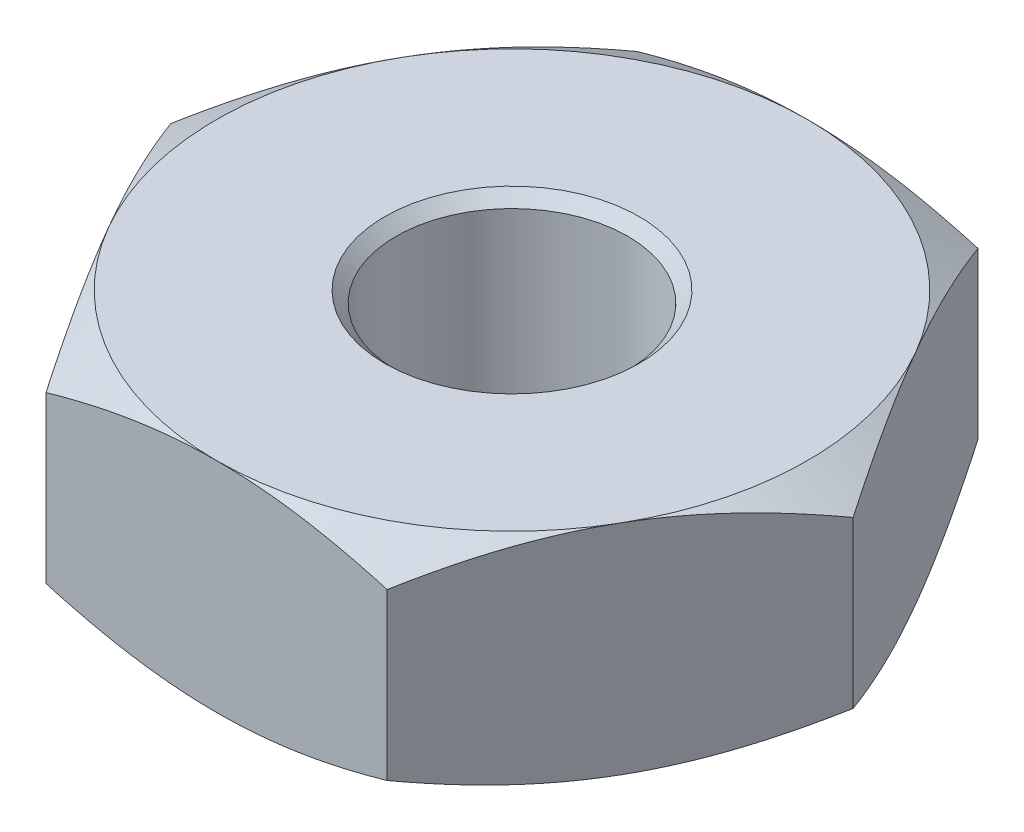
from build123d import *

# Parameters (mm, degrees)
BOSS_EXTRUDE1_DEPTH    = 9.6
SKETCH2_OUTSIDE_W      = 73.45
SKETCH2_OUTSIDE_H      = 69.428
SKETCH2_OUTSIDE_R      = 13
CUT_EXTRUDE1_DEPTH     = 9.6
CUT_EXTRUDE1_DRAFT     = -60
SKETCH3_OUTSIDE_W      = 73.45
SKETCH3_OUTSIDE_H      = 69.428
SKETCH3_OUTSIDE_R      = 13
CUT_EXTRUDE2_DEPTH     = 9.6
CUT_EXTRUDE2_DRAFT     = -60
M12_TAPPED_HOLE1_D     = 10.2
M12_TAPPED_HOLE1_DEPTH = 32.75
CHAMFER1_SIZE          = 0.5


with BuildPart() as part:
    # Sketch1 → Boss-Extrude1 (new body)
    with BuildSketch(Plane(origin=(0, 0, 0), x_dir=(1, 0, 0), z_dir=(0, 1, 0))):
        Polygon((15.011106999, 0), (7.505553499, 13), (-7.505553499, 13), (-15.011106999, 0), (-7.505553499, -13), (7.505553499, -13), align=None)
    extrude(amount=BOSS_EXTRUDE1_DEPTH)


with BuildPart() as cut_extrude1_tool:
    # Sketch2 outside → Cut-Extrude1 (with draft: the straight prism first)
    with BuildSketch(Plane(origin=(0, 9.6, 0), x_dir=(1, 0, 0), z_dir=(0, 1, 0))):
        Rectangle(SKETCH2_OUTSIDE_W, SKETCH2_OUTSIDE_H)
        Circle(SKETCH2_OUTSIDE_R, mode=Mode.SUBTRACT)
    extrude(amount=-CUT_EXTRUDE1_DEPTH)
    # Cut-Extrude1: the draft: its side faces are tilted about the plane it starts from
    cut_extrude1_sides = [cut_extrude1_tool.faces().sort_by_distance(p)[0] for p in [
        (0, 4.8, 34.714),
        (36.725, 4.8, 0),
        (0, 4.8, -34.714),
        (-36.725, 4.8, 0),
        (-13, 4.8, 0),
    ]]
    draft(cut_extrude1_sides, Plane(origin=(0, 9.6, 0), x_dir=(1, 0, 0), z_dir=(0, 1, 0)), CUT_EXTRUDE1_DRAFT)


with BuildPart() as part_1:
    add(part.part)

    # Cut-Extrude1: cut by cut_extrude1_tool
    add(cut_extrude1_tool.part, mode=Mode.SUBTRACT)


with BuildPart() as cut_extrude2_tool:
    # Sketch3 outside → Cut-Extrude2 (with draft: the straight prism first)
    with BuildSketch(Plane.XZ):
        Rectangle(SKETCH3_OUTSIDE_W, SKETCH3_OUTSIDE_H)
        Circle(SKETCH3_OUTSIDE_R, mode=Mode.SUBTRACT)
    extrude(amount=-CUT_EXTRUDE2_DEPTH)
    # Cut-Extrude2: the draft: its side faces are tilted about the plane it starts from
    cut_extrude2_sides = [cut_extrude2_tool.faces().sort_by_distance(p)[0] for p in [
        (0, 4.8, -34.714),
        (36.725, 4.8, 0),
        (0, 4.8, 34.714),
        (-36.725, 4.8, 0),
        (-13, 4.8, 0),
    ]]
    draft(cut_extrude2_sides, Plane.XZ, CUT_EXTRUDE2_DRAFT)


with BuildPart() as part_2:
    add(part_1.part)

    # Cut-Extrude2: cut by cut_extrude2_tool
    add(cut_extrude2_tool.part, mode=Mode.SUBTRACT)

    # M12 Tapped Hole1
    with Locations(Plane(origin=(0, 9.6, 0), x_dir=(1, 0, 0), z_dir=(0, 1, 0))):
        with Locations((0, 0)):
            Hole(M12_TAPPED_HOLE1_D / 2, depth=M12_TAPPED_HOLE1_DEPTH)

    # Chamfer1
    chamfer1_edges = [part_2.edges().sort_by_distance(p)[0] for p in [
        (5.1, 0, 0),
        (5.1, 9.6, 0),
    ]]
    chamfer(chamfer1_edges, length=CHAMFER1_SIZE)


solid = part_2.part
